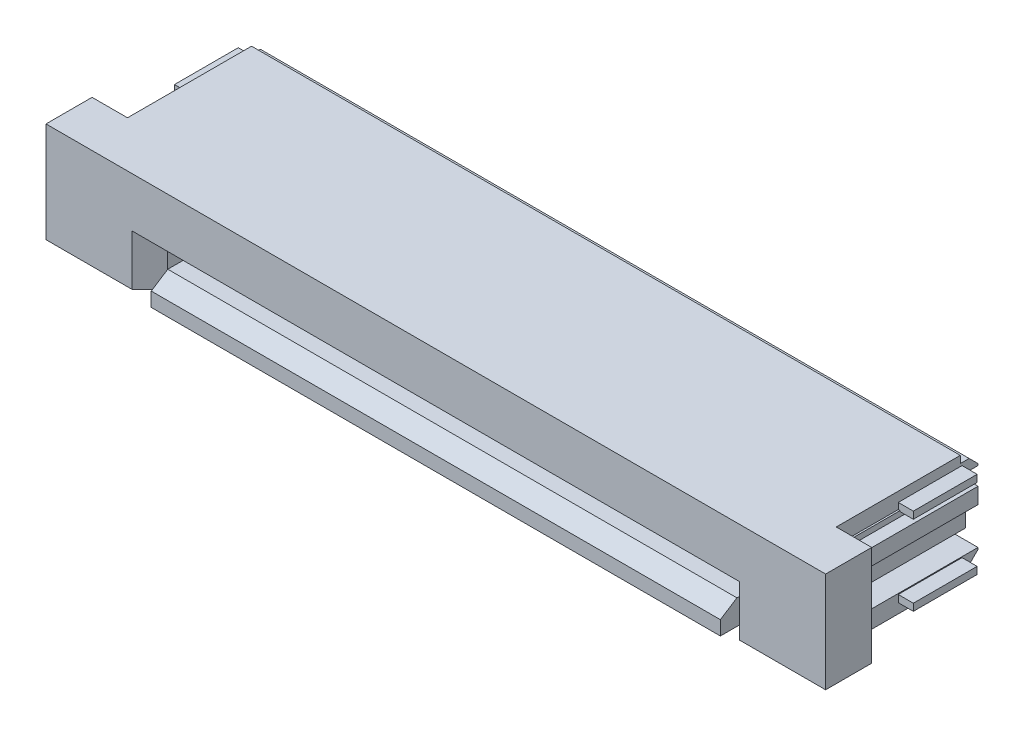
from build123d import *

# Parameters (mm, degrees)
BASE_DEPTH              = 10
SKETCH2_W               = 16.2
SKETCH2_H               = 1.55
CARD_SLOT_DEPTH         = 3.8
SKETCH4_W               = 1.775
SKETCH4_H               = 2
WINGS_DEPTH             = 11.874281585
FRONT_START             = -1.3
SKETCH5_W               = 1.97
SKETCH5_H               = 3
FRONT_LEAD_IN_DEPTH     = 1.3
CARD_SLOT_LEAD_IN_SIZE  = 0.1
CARD_SLOT_LEAD_IN_SIZE2 = 0.173205081
WT_DEPTH                = 1.8
GATE_DEPTH              = 1.3
GATE_CHAMFER_SIZE       = 0.5
GATE_GUIDE_DEPTH        = 3.6
F_01_CONTACT_DEPTH      = 0.125
LPATTERN3_COUNT         = 15
LPATTERN3_PITCH         = 1


with BuildPart() as part:
    # Sketch1 → Base (new, symmetric)
    with BuildSketch(Plane(origin=(0, 0, 0), x_dir=(0, 0, -1), z_dir=(1, 0, 0))):
        Polygon((-1.75, 1.5), (1.75, 1.5), (1.75, 1.3), (2, 1.3), (2.25, 1.05), (2.25, -1.05), (2, -1.3), (1.75, -1.3), (1.75, -1.5), (-3.05, -1.5), (-3.05, -1.1), (-2.35, -0.65), (-1.75, -0.65), align=None)
    extrude(amount=BASE_DEPTH, both=True)

    # Sketch2 → Card Slot (cut)
    with BuildSketch(Plane.XY.offset(3.05)):
        with Locations((0, -0.025)):
            Rectangle(SKETCH2_W, SKETCH2_H)
    extrude(amount=-CARD_SLOT_DEPTH, mode=Mode.SUBTRACT)

    # Sketch4 → Wings (cut, through all)
    with BuildSketch(Plane.XY.offset(1.75)):
        with Locations((-9.1125, 0)):
            Rectangle(SKETCH4_W, SKETCH4_H)
        with Locations((9.1125, 0)):
            Rectangle(SKETCH4_W, SKETCH4_H)
    extrude(amount=-WINGS_DEPTH, mode=Mode.SUBTRACT)

    # Sketch5 → Front Lead In (cut)
    with BuildSketch(Plane.XY.offset(3.05).offset(FRONT_START)):
        with Locations((-9.015, 0)):
            Rectangle(SKETCH5_W, SKETCH5_H)
        with Locations((9.015, 0)):
            Rectangle(SKETCH5_W, SKETCH5_H)
    extrude(amount=FRONT_LEAD_IN_DEPTH, mode=Mode.SUBTRACT)

    # Card Slot Lead In
    card_slot_lead_in_edges = [part.edges().sort_by_distance(p)[0] for p in [
        (0, 0.75, 1.75),
        (-8.1, -0.025, 1.75),
        (8.1, -0.025, 1.75),
    ]]
    card_slot_lead_in_side = [part.faces().sort_by_distance(p)[0] for p in [
        (0, 0.819195673, 1.75),
    ]]
    chamfer(card_slot_lead_in_edges, length=CARD_SLOT_LEAD_IN_SIZE, length2=CARD_SLOT_LEAD_IN_SIZE2, reference=card_slot_lead_in_side[0])

    # Sketch8 → WT (add)
    with BuildSketch(Plane.XY):
        with BuildLine():
            Line((-10.425, 1.025), (-8.575, 1.025))
            ThreePointArc((-8.575, 1.025), (-8.468933983, 0.981066017), (-8.425, 0.875))
            Line((-8.425, 0.875), (-8.425, -0.875))
            ThreePointArc((-8.425, -0.875), (-8.468933983, -0.981066017), (-8.575, -1.025))
            Line((-8.575, -1.025), (-10.425, -1.025))
            Line((-10.425, -1.025), (-10.425, -1.225))
            Line((-10.425, -1.225), (-8.575, -1.225))
            ThreePointArc((-8.575, -1.225), (-8.327512627, -1.122487373), (-8.225, -0.875))
            Line((-8.225, -0.875), (-8.225, 0.875))
            ThreePointArc((-8.225, 0.875), (-8.327512627, 1.122487373), (-8.575, 1.225))
            Line((-8.575, 1.225), (-10.425, 1.225))
            Line((-10.425, 1.225), (-10.425, 1.025))
        make_face()
        with BuildLine():
            Line((10.425, 1.025), (8.575, 1.025))
            ThreePointArc((8.575, 1.025), (8.468933983, 0.981066017), (8.425, 0.875))
            Line((8.425, 0.875), (8.425, -0.875))
            ThreePointArc((8.425, -0.875), (8.468933983, -0.981066017), (8.575, -1.025))
            Line((8.575, -1.025), (10.425, -1.025))
            Line((10.425, -1.025), (10.425, -1.225))
            Line((10.425, -1.225), (8.575, -1.225))
            ThreePointArc((8.575, -1.225), (8.327512627, -1.122487373), (8.225, -0.875))
            Line((8.225, -0.875), (8.225, 0.875))
            ThreePointArc((8.225, 0.875), (8.327512627, 1.122487373), (8.575, 1.225))
            Line((8.575, 1.225), (10.425, 1.225))
            Line((10.425, 1.225), (10.425, 1.025))
        make_face()
    extrude(amount=-WT_DEPTH)

    # Sketch9 → Gate (add)
    with BuildSketch(Plane.XY.offset(1.75)):
        Polygon((8.07, 0.1), (8.07, -1.33), (11, -1.33), (11, 1.5), (-11, 1.5), (-11, -1.33), (-8.07, -1.33), (-8.07, 0.1), align=None)
    extrude(amount=GATE_DEPTH)

    # Gate Chamfer
    gate_chamfer_edges = [part.edges().sort_by_distance(p)[0] for p in [
        (-8.07, -0.615, 3.05),
        (8.07, -0.615, 3.05),
    ]]
    chamfer(gate_chamfer_edges, length=GATE_CHAMFER_SIZE)

    # Sketch10 → Gate Guide (add)
    with BuildSketch(Plane(origin=(0, 0, 1.75), x_dir=(-1, 0, 0), z_dir=(0, 0, -1))):
        Polygon((-10.05, -0.3), (-10.05, 0.44506), (-10.4, 0.44506), (-10.4, 0.89506), (-10.05, 0.89506), (-10.05, 1.05), (-9.4, 1.05), (-9.4, 0.375499815), (-9.125, 0.375499815), (-9.125, -0.201850454), (-9.5, -0.201850454), (-9.5, -0.3), align=None)
        Polygon((9.125, -0.201850454), (9.125, 0.375499815), (9.4, 0.375499815), (9.4, 1.05), (10.05, 1.05), (10.05, 0.89506), (10.4, 0.89506), (10.4, 0.44506), (10.05, 0.44506), (10.05, -0.3), (9.5, -0.3), (9.5, -0.201850454), align=None)
    extrude(amount=GATE_GUIDE_DEPTH)

    # Sketch13 → -01 Contact (add, symmetric)
    with BuildSketch(Plane(origin=(7, 0, 0), x_dir=(0, 0, -1), z_dir=(1, 0, 0))):
        with BuildLine():
            ThreePointArc((1.091468707, -0.7696), (1.268245402, -0.696376695), (1.341468707, -0.5196))
            Line((1.341468707, -0.5196), (1.341468707, -0.44900832))
            ThreePointArc((1.341468707, -0.44900832), (1.111505179, 0.091419351), (0.562636527, 0.300437279))
            Line((0.562636527, 0.300437279), (-1.104507646, 0.2363))
            ThreePointArc((-1.104507646, 0.2363), (-1.202075654, 0.195944223), (-1.25, 0.101862545))
            ThreePointArc((-1.25, 0.101862545), (-1.295444824, 0.048293017), (-1.362451828, 0.069387751))
            Line((-1.362451828, 0.069387751), (-1.649820024, 0.424987751))
            ThreePointArc((-1.649820024, 0.424987751), (-1.649328111, 0.505413401), (-1.570395768, 0.520847536))
            ThreePointArc((-1.570395768, 0.520847536), (-1.36954416, 0.449036779), (-1.1564545, 0.4395))
            Line((-1.1564545, 0.4395), (1.138268707, 0.6804))
            Line((1.138268707, 0.6804), (1.551768707, 0.6804))
            ThreePointArc((1.551768707, 0.6804), (1.650551525, 0.639482817), (1.691468707, 0.5407))
            ThreePointArc((1.691468707, 0.5407), (1.830262642, 0.551847257), (1.896637232, 0.67425))
            Line((1.896637232, 0.67425), (1.896637232, 0.677234263))
            ThreePointArc((1.896637232, 0.677234263), (2.07345297, 0.85405), (2.250268707, 0.677234263))
            Line((2.250268707, 0.677234263), (2.250268707, 0.324203125))
            ThreePointArc((2.250268707, 0.324203125), (2.212168707, 0.2234), (2.250268707, 0.122596875))
            Line((2.250268707, 0.122596875), (2.250268707, -0.561796875))
            ThreePointArc((2.250268707, -0.561796875), (2.225665582, -0.725303125), (2.364568707, -0.815))
            Line((2.364568707, -0.815), (2.505907985, -0.815))
            ThreePointArc((2.505907985, -0.815), (2.630745337, -0.837012193), (2.740525462, -0.900393778))
            Line((2.740525462, -0.900393778), (3.069017668, -1.176031466))
            ThreePointArc((3.069017668, -1.176031466), (3.12631387, -1.209111444), (3.191468707, -1.2206))
            Line((3.191468707, -1.2206), (3.648668707, -1.2206))
            ThreePointArc((3.648668707, -1.2206), (3.720510756, -1.250357951), (3.750268707, -1.3222))
            Line((3.750268707, -1.3222), (3.750268707, -1.3984))
            ThreePointArc((3.750268707, -1.3984), (3.720510756, -1.470242049), (3.648668707, -1.5))
            Line((3.648668707, -1.5), (3.191468707, -1.5))
            ThreePointArc((3.191468707, -1.5), (3.030753442, -1.471661563), (2.889422809, -1.390064284))
            Line((2.889422809, -1.390064284), (2.60967503, -1.155328025))
            ThreePointArc((2.60967503, -1.155328025), (2.402653987, -1.096846191), (2.221577699, -1.21298927))
            ThreePointArc((2.221577699, -1.21298927), (2.023089184, -1.285925543), (1.896637232, -1.116434263))
            Line((1.896637232, -1.116434263), (1.896637232, -1.11345))
            ThreePointArc((1.896637232, -1.11345), (1.830262642, -0.991047257), (1.691468707, -0.9799))
            ThreePointArc((1.691468707, -0.9799), (1.650551525, -1.078682817), (1.551768707, -1.1196))
            Line((1.551768707, -1.1196), (-1.375731293, -1.1196))
            ThreePointArc((-1.375731293, -1.1196), (-1.44817573, -1.064011428), (-1.413231293, -0.979648095))
            Line((-1.413231293, -0.979648095), (-1.066821131, -0.779648095))
            ThreePointArc((-1.066821131, -0.779648095), (-1.04873256, -0.772155563), (-1.029321131, -0.7696))
            Line((-1.029321131, -0.7696), (1.091468707, -0.7696))
        make_face()
    f_01_contact = extrude(amount=F_01_CONTACT_DEPTH, both=True)

    # LPattern3: -01 Contact ×15
    with Locations(*[(-i * LPATTERN3_PITCH, 0, 0) for i in range(1, LPATTERN3_COUNT)]):
        add(f_01_contact)


solid = part.part
